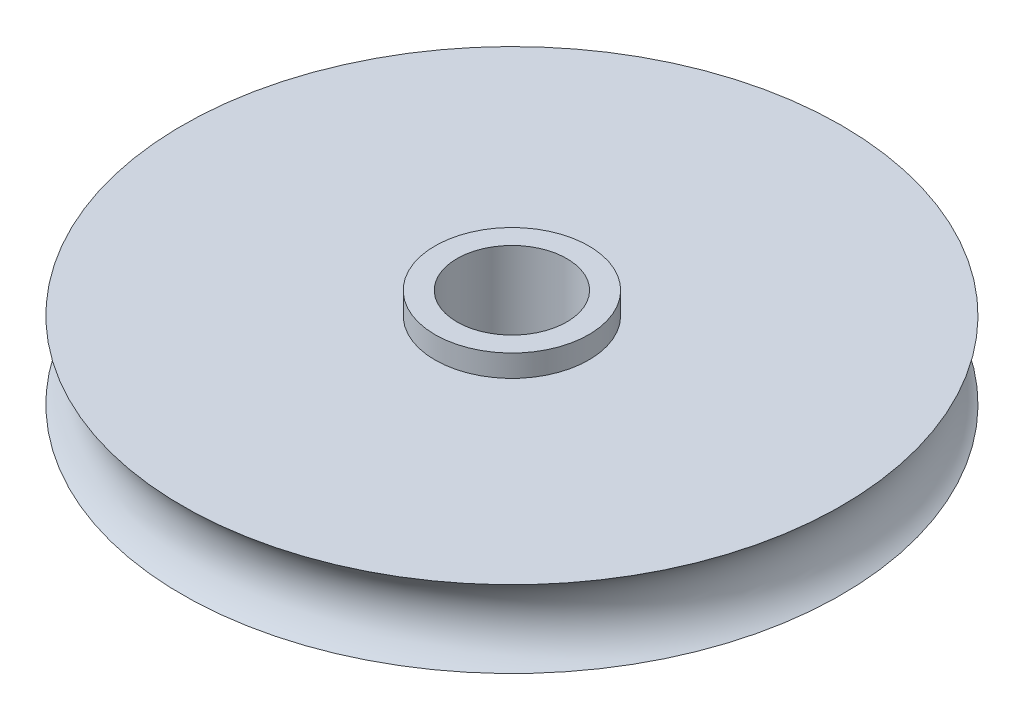
from build123d import *

# Parameters (mm, degrees)
SKETCH1_R               = 15
BOSS_EXTRUDE1_DEPTH     = 3.5
SKETCH2_R               = 2.121909517
SKETCH4_R               = 3.5
BOSS_EXTRUDE2_DEPTH     = 1
BOSS_EXTRUDE3_START     = 1
SKETCH5_R               = 3.5
BOSS_EXTRUDE3_DEPTH     = 1
CUT_EXTRUDE1_DEPTH      = 22.685248442
CUT_EXTRUDE1_DEPTH_BACK = 22.685248442
SKETCH3_R               = 2.5


with BuildPart() as part:
    # Sketch1 → Boss-Extrude1 (new body)
    with BuildSketch(Plane(origin=(0, 0, 0), x_dir=(1, 0, 0), z_dir=(0, 1, 0))):
        with Locations(Location((0, 0, 0), (0, 0, 270))):
            Circle(SKETCH1_R)
    extrude(amount=BOSS_EXTRUDE1_DEPTH)

    # Sketch2 → Cut-Revolve1 (revolve, cut)
    with BuildSketch(Plane(origin=(0, 0, 0), x_dir=(0, 0, -1), z_dir=(1, 0, 0)), mode=Mode.PRIVATE) as cut_revolve1_sk:
        with Locations((-16.2, 1.75)):
            Circle(SKETCH2_R)
    revolve(cut_revolve1_sk.sketch.rotate(Axis((0, 0, 0), (0, 1, 0)), 180), axis=Axis((0, 0, 0), (0, 1, 0)), mode=Mode.SUBTRACT)

    # Sketch4 → Boss-Extrude2 (add)
    with BuildSketch(Plane.XZ):
        with Locations(Location((0, 0, 0), (0, 0, 270))):
            Circle(SKETCH4_R)
    extrude(amount=BOSS_EXTRUDE2_DEPTH)

    # Sketch5 → Boss-Extrude3 (add)
    with BuildSketch(Plane(origin=(0, 3.5, 0), x_dir=(1, 0, 0), z_dir=(0, 1, 0)).offset(BOSS_EXTRUDE3_START)):
        with Locations(Location((0, 0, 0), (0, 0, 90))):
            Circle(SKETCH5_R)
    extrude(amount=-BOSS_EXTRUDE3_DEPTH)

    # Sketch3 → Cut-Extrude1 (cut, two sides: drawn at the far end of the back side and taken through both)
    with BuildSketch(Plane(origin=(0, 3.5, 0), x_dir=(1, 0, 0), z_dir=(0, 1, 0)).offset(-CUT_EXTRUDE1_DEPTH_BACK)):
        with Locations(Location((0, 0, 0), (0, 0, 270))):
            Circle(SKETCH3_R)
    extrude(amount=CUT_EXTRUDE1_DEPTH + CUT_EXTRUDE1_DEPTH_BACK, mode=Mode.SUBTRACT)


solid = part.part
